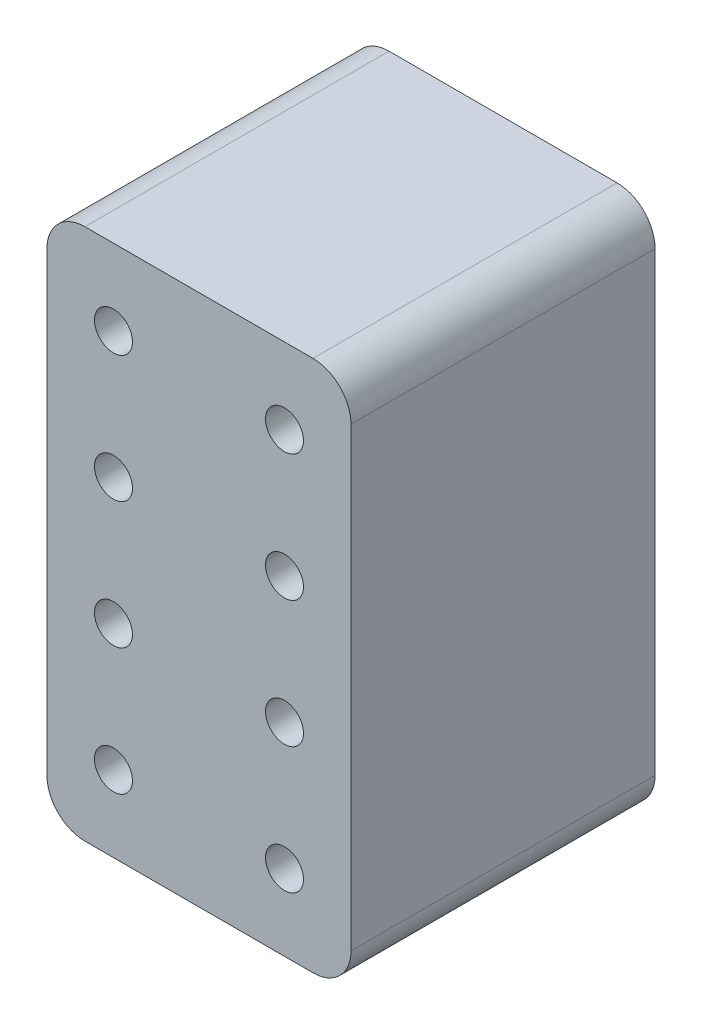
from build123d import *

# Parameters (mm, degrees)
SKETCH_1_R      = 2
EXTRUDE_1_DEPTH = 32


with BuildPart() as part:
    # 草图1 → 凸台-拉伸1 (new body)
    with BuildSketch(Plane.XY):
        with BuildLine():
            Line((12, 28), (-12, 28))
            ThreePointArc((-12, 28), (-14.828427125, 26.828427125), (-16, 24))
            Line((-16, 24), (-16, -24))
            ThreePointArc((-16, -24), (-14.828427125, -26.828427125), (-12, -28))
            Line((-12, -28), (12, -28))
            ThreePointArc((12, -28), (14.828427125, -26.828427125), (16, -24))
            Line((16, -24), (16, 24))
            ThreePointArc((16, 24), (14.828427125, 26.828427125), (12, 28))
        make_face()
        with Locations((9, 20)):
            Circle(SKETCH_1_R, mode=Mode.SUBTRACT)
        with Locations((9, 6.666666667)):
            Circle(SKETCH_1_R, mode=Mode.SUBTRACT)
        with Locations((9, -6.666666667)):
            Circle(SKETCH_1_R, mode=Mode.SUBTRACT)
        with Locations((9, -20)):
            Circle(SKETCH_1_R, mode=Mode.SUBTRACT)
        with Locations(Location((-9, -20, 0), (0, 0, 180))):
            Circle(SKETCH_1_R, mode=Mode.SUBTRACT)
        with Locations(Location((-9, -6.666666667, 0), (0, 0, 180))):
            Circle(SKETCH_1_R, mode=Mode.SUBTRACT)
        with Locations(Location((-9, 6.666666667, 0), (0, 0, 180))):
            Circle(SKETCH_1_R, mode=Mode.SUBTRACT)
        with Locations(Location((-9, 20, 0), (0, 0, 180))):
            Circle(SKETCH_1_R, mode=Mode.SUBTRACT)
    extrude(amount=EXTRUDE_1_DEPTH)


solid = part.part
